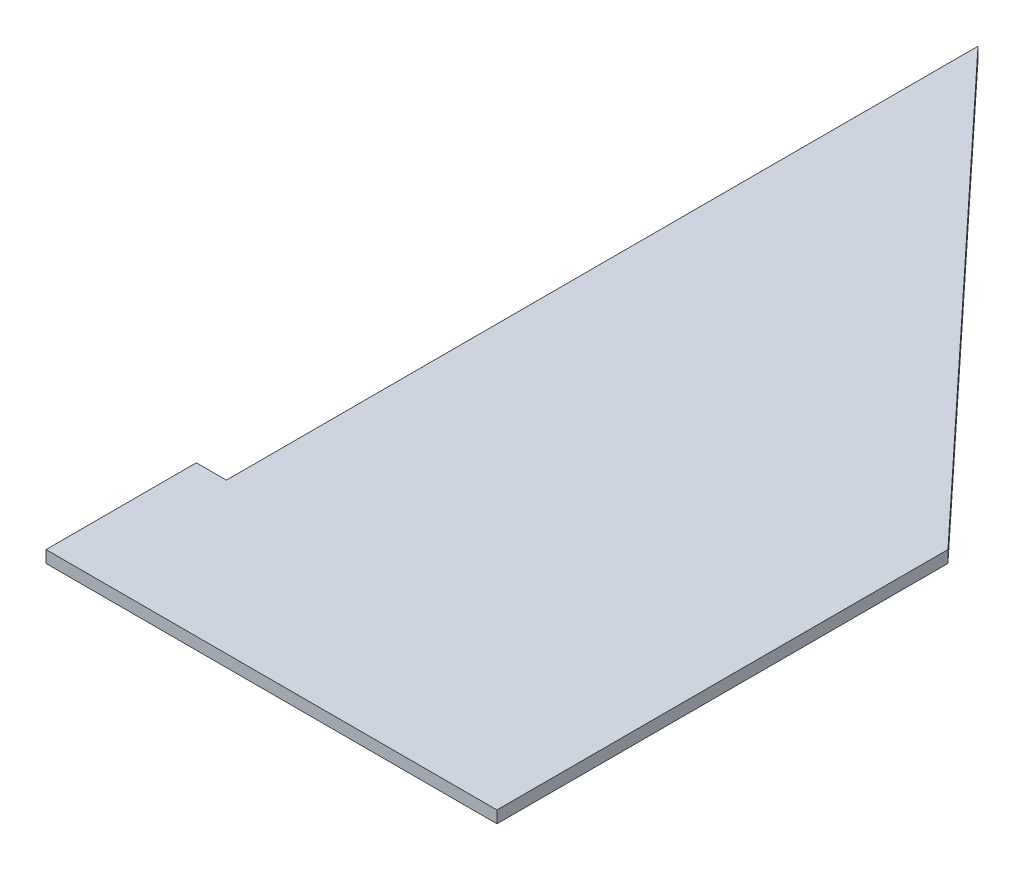
from build123d import *

# Parameters (mm, degrees)
ESTRUSIONE_ESTRUSIONE1_DEPTH      = 2
ESTRUSIONE_ESTRUSIONE1_DEPTH_BACK = 2


with BuildPart() as part:
    # Forma aletta → Estrusione-Estrusione1 (new, two sides: drawn at the far end of the back side and taken through both)
    with BuildSketch(Plane(origin=(0, 0, 0), x_dir=(1, 0, 0), z_dir=(0, 1, 0)).offset(-ESTRUSIONE_ESTRUSIONE1_DEPTH_BACK)):
        Polygon((0, 300), (0, 50), (-10, 50), (-10, 0), (0, 0), (140, 0), (140, 150), align=None)
    extrude(amount=ESTRUSIONE_ESTRUSIONE1_DEPTH + ESTRUSIONE_ESTRUSIONE1_DEPTH_BACK)


solid = part.part
